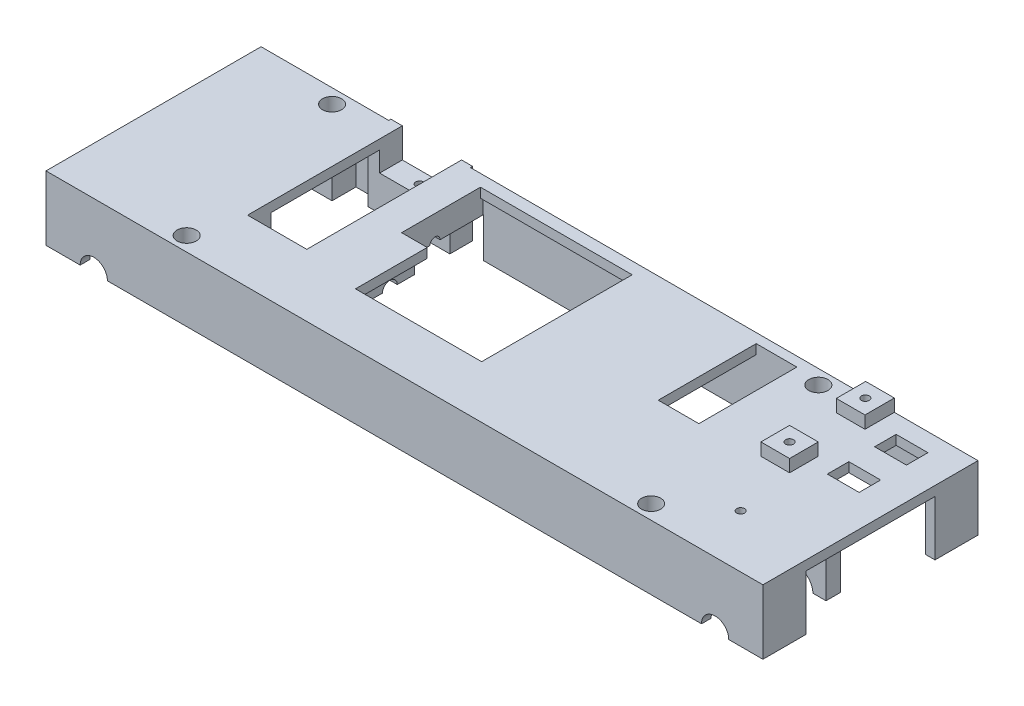
from build123d import *

# Parameters (mm, degrees)
SKETCH_1_W           = 150
SKETCH_1_H           = 45
EXTRUDE_1_DEPTH      = 2
SKETCH_3_W           = 12
SKETCH_3_H           = 3
SKETCH_3_W_2         = 3
SKETCH_3_H_2         = 10
SKETCH_3_H_3         = 10.3
SKETCH_3_W_3         = 19.4
EXTRUDE_2_DEPTH      = 11.5
CUT_EXTRUDE_1_REACH  = 90.217
SKETCH_4_R           = 2.85
CUT_EXTRUDE_2_REACH  = 129.602
SKETCH_5_R           = 1.6
EXTRUDE_START        = -13.5
SKETCH_6_W           = 18.974736579
SKETCH_6_H           = 4.7514
SKETCH_6_R           = 0.825
SKETCH_6_W_2         = 17.092
EXTRUDE_3_DEPTH      = 13.5
CUT_EXTRUDE_START    = -6.1974
SKETCH_7_W           = 12.392
SKETCH_7_H           = 32.3834
SKETCH_7_W_2         = 8.5
SKETCH_7_H_2         = 20.5
CUT_EXTRUDE_3_DEPTH  = 6.1974
SKETCH_8_W           = 2.5
SKETCH_8_H           = 9
SKETCH_8_H_2         = 8
EXTRUDE_4_DEPTH      = 20
SKETCH_9_W           = 4.5
SKETCH_9_H           = 26.7
SKETCH_9_W_2         = 6.45
EXTRUDE_5_DEPTH      = 3.3
SKETCH_10_W          = 6.45
SKETCH_10_H          = 11.7
EXTRUDE_6_DEPTH      = 4.2
CUT_EXTRUDE_START_2  = -2
SKETCH_12_R          = 1.55
SKETCH_12_R_2        = 1.05
CUT_EXTRUDE_4_DEPTH  = 37.7
SKETCH_14_W          = 6.65
SKETCH_14_H          = 8.3
SKETCH_14_W_2        = 4.7
CUT_EXTRUDE_5_DEPTH  = 2.1
CUT_EXTRUDE_6_REACH  = 82.009
SKETCH_15_R          = 0.825
CUT_EXTRUDE_7_REACH  = 82.943
SKETCH_17_W          = 6.65
SKETCH_17_H          = 4.500055298
SKETCH_18_W          = 6
SKETCH_18_H          = 6.15
SKETCH_18_H_2        = 6
EXTRUDE_7_DEPTH      = 2.6
CUT_EXTRUDE_8_REACH  = 84.201
SKETCH_19_R          = 0.825
SKETCH_21_W          = 8
SKETCH_21_H          = 5
SKETCH_21_W_2        = 7
EXTRUDE_9_DEPTH      = 13.5
SKETCH_22_R          = 2
CUT_EXTRUDE_9_DEPTH  = 11.5
CUT_EXTRUDE_10_REACH = 83.46
SKETCH_23_R          = 1
CUT_EXTRUDE_START_3  = -17.2
SKETCH_24_R          = 3.25
CUT_EXTRUDE_11_DEPTH = 15.7
CUT_EXTRUDE_12_REACH = 83.46
SKETCH_20_R          = 0.825


with BuildPart() as part:
    # 草图1 → 凸台-拉伸1 (new body)
    with BuildSketch(Plane(origin=(0, 0, 0), x_dir=(1, 0, 0), z_dir=(0, 1, 0))):
        Rectangle(SKETCH_1_W, SKETCH_1_H)
    extrude(amount=EXTRUDE_1_DEPTH)

    # 草图3 → 凸台-拉伸2 (add)
    with BuildSketch(Plane.XZ):
        Polygon((-75, 13.5), (-73, 13.5), (-73, 20.5), (73, 20.5), (73, 13.5), (75, 13.5), (75, 22.5), (-75, 22.5), align=None)
        Polygon((-75, -13.5), (-73, -13.5), (-73, -20.5), (73, -20.5), (73, -13.5), (75, -13.5), (75, -22.5), (-75, -22.5), align=None)
        with Locations((65, 3.8)):
            Rectangle(SKETCH_3_W, SKETCH_3_H)
        with Locations((-65, 3.8)):
            Rectangle(SKETCH_3_W, SKETCH_3_H)
        with Locations((-65, -8.9)):
            Rectangle(SKETCH_3_W, SKETCH_3_H)
        with Locations((-48.574736579, 11.5)):
            Rectangle(SKETCH_3_W_2, SKETCH_3_H_2)
        with Locations((-25.35, 11.35)):
            Rectangle(SKETCH_3_W_2, SKETCH_3_H_3)
        with Locations((48.614736579, 11.5)):
            Rectangle(SKETCH_3_W_2, SKETCH_3_H_2)
        with Locations((21.3, 1.5)):
            Rectangle(SKETCH_3_W_3, SKETCH_3_H)
    extrude(amount=EXTRUDE_2_DEPTH)

    # 切除-拉伸1: up to this face of the body (flat: up to its plane)
    cut_extrude_1_end = Plane(part.part.faces().sort_by_distance((0, -4.75, 22.5))[0])
    # 草图4 → 切除-拉伸1 (cut, up to the picked face)
    with BuildSketch(Plane(origin=(0, 0, -22.5), x_dir=(-1, 0, 0), z_dir=(0, 0, -1)), mode=Mode.PRIVATE) as cut_extrude_1_sk1:
        with Locations((-65, -11.5)):
            Circle(SKETCH_4_R)
    cut_extrude_1_tool1 = split(extrude(cut_extrude_1_sk1.sketch, amount=-CUT_EXTRUDE_1_REACH, mode=Mode.PRIVATE), bisect_by=cut_extrude_1_end, keep=Keep.BOTH, mode=Mode.PRIVATE)
    # 草图4 → 切除-拉伸1 (cut, up to the picked face)
    with BuildSketch(Plane(origin=(0, 0, -22.5), x_dir=(-1, 0, 0), z_dir=(0, 0, -1)), mode=Mode.PRIVATE) as cut_extrude_1_sk2:
        with Locations((65, -11.5)):
            Circle(SKETCH_4_R)
    cut_extrude_1_tool2 = split(extrude(cut_extrude_1_sk2.sketch, amount=-CUT_EXTRUDE_1_REACH, mode=Mode.PRIVATE), bisect_by=cut_extrude_1_end, keep=Keep.BOTH, mode=Mode.PRIVATE)
    add(cut_extrude_1_tool1.solids().sort_by(Axis((65, -11.5, -22.5), (0, 0, 1)))[0], mode=Mode.SUBTRACT)
    add(cut_extrude_1_tool2.solids().sort_by(Axis((-65, -11.5, -22.5), (0, 0, 1)))[0], mode=Mode.SUBTRACT)

    # 草图5 → 切除-拉伸2 (cut, up to next)
    with BuildSketch(Plane.ZY.offset(50.074736579), mode=Mode.PRIVATE) as cut_extrude_2_sk1:
        with Locations((11.5, -11.5)):
            Circle(SKETCH_5_R)
    cut_extrude_2_tool1 = extrude(cut_extrude_2_sk1.sketch, amount=-CUT_EXTRUDE_2_REACH, mode=Mode.PRIVATE) & part.part
    add(cut_extrude_2_tool1.solids().sort_by_distance((-50.074737, -11.5, 11.5))[0], mode=Mode.SUBTRACT)
    add(cut_extrude_2_tool1.solids().sort_by_distance((-50.074737, -11.5, 11.5))[1], mode=Mode.SUBTRACT)
    add(cut_extrude_2_tool1.solids().sort_by_distance((-50.074737, -11.5, 11.5))[2], mode=Mode.SUBTRACT)

    # 草图6 → 凸台-拉伸3 (add)
    # profile 1 of 2: a face of its own
    with BuildSketch(Plane(origin=(0, 2, 0), x_dir=(1, 0, 0), z_dir=(0, 1, 0)).offset(EXTRUDE_START)):
        with Locations((-40.58736829, -6.9563)):
            Rectangle(SKETCH_6_W, SKETCH_6_H)
        with Locations(Location((-39.696, -6.7666, 0), (0, 0, 270))):
            Circle(SKETCH_6_R, mode=Mode.SUBTRACT)
    # profile 2 of 2: a face of its own
    with BuildSketch(Plane(origin=(0, 2, 0), x_dir=(1, 0, 0), z_dir=(0, 1, 0)).offset(EXTRUDE_START)):
        with Locations((-39.746, 20.5757)):
            Rectangle(SKETCH_6_W_2, SKETCH_6_H)
        with Locations((-39.696, 20.386)):
            Circle(SKETCH_6_R, mode=Mode.SUBTRACT)
    extrude(amount=EXTRUDE_3_DEPTH)

    # 草图7 → 切除-拉伸3 (cut)
    with BuildSketch(Plane(origin=(0, 2, 0), x_dir=(1, 0, 0), z_dir=(0, 1, 0)).offset(CUT_EXTRUDE_START)):
        with Locations((-39.696, 6.7597)):
            Rectangle(SKETCH_7_W, SKETCH_7_H)
        Polygon((-26.6, 20), (5.15, 20), (5.15, -11.5), (-21.25, -11.5), (-21.25, -3.25), (-21.25, 3.5), (-26.6, 3.5), align=None)
        with Locations((34.85, 10.25)):
            Rectangle(SKETCH_7_W_2, SKETCH_7_H_2)
    extrude(amount=CUT_EXTRUDE_3_DEPTH, mode=Mode.SUBTRACT)

    # 草图8 → 凸台-拉伸4 (add)
    with BuildSketch(Plane.XZ):
        with Locations((40.35, -4.5)):
            Rectangle(SKETCH_8_W, SKETCH_8_H)
        with Locations((40.35, -16.5)):
            Rectangle(SKETCH_8_W, SKETCH_8_H_2)
    extrude(amount=EXTRUDE_4_DEPTH)

    # 草图9 → 凸台-拉伸5 (add)
    with BuildSketch(Plane.XZ):
        with Locations((-28.85, -7.15)):
            Rectangle(SKETCH_9_W, SKETCH_9_H)
        with Locations((8.375, -7.15)):
            Rectangle(SKETCH_9_W_2, SKETCH_9_H)
    extrude(amount=EXTRUDE_5_DEPTH)

    # 草图10 → 凸台-拉伸6 (add)
    with BuildSketch(Plane.XZ):
        with Locations((8.375, 0.35)):
            Rectangle(SKETCH_10_W, SKETCH_10_H)
        Polygon((-31.1, 6.2), (-23.85, 6.2), (-23.85, -3.5), (-26.6, -3.5), (-26.6, -6.5), (-31.1, -6.5), align=None)
    extrude(amount=EXTRUDE_6_DEPTH)

    # 草图12 → 切除-拉伸4 (cut)
    with BuildSketch(Plane.ZY.offset(31.1).offset(CUT_EXTRUDE_START_2)):
        with Locations((1.7, -4.2)):
            Circle(SKETCH_12_R)
        with Locations((-10.5, -3.3)):
            Circle(SKETCH_12_R_2)
    extrude(amount=-CUT_EXTRUDE_4_DEPTH, mode=Mode.SUBTRACT)

    # 草图14 → 切除-拉伸5 (cut)
    with BuildSketch(Plane(origin=(0, 0, -22.5), x_dir=(-1, 0, 0), z_dir=(0, 0, -1))):
        with Locations((-8.375, -7.35)):
            Rectangle(SKETCH_14_W, SKETCH_14_H)
        with Locations((28.85, -7.35)):
            Rectangle(SKETCH_14_W_2, SKETCH_14_H)
    extrude(amount=-CUT_EXTRUDE_5_DEPTH, mode=Mode.SUBTRACT)

    # 草图15 → 切除-拉伸6 (cut, up to next)
    with BuildSketch(Plane(origin=(0, -4.1974, 0), x_dir=(1, 0, 0), z_dir=(0, 1, 0)), mode=Mode.PRIVATE) as cut_extrude_6_sk1:
        with Locations(Location((-39.696, 20.386, 0), (0, 0, 90))):
            Circle(SKETCH_15_R)
    cut_extrude_6_tool1 = extrude(cut_extrude_6_sk1.sketch, amount=-CUT_EXTRUDE_6_REACH, mode=Mode.PRIVATE) & part.part
    add(cut_extrude_6_tool1.solids().sort_by_distance((-39.696, -4.1974, -20.386))[0], mode=Mode.SUBTRACT)

    # 草图17 → 切除-拉伸7 (cut, up to next)
    with BuildSketch(Plane.XZ, mode=Mode.PRIVATE) as cut_extrude_7_sk1:
        with Locations((65, -6.549972351)):
            Rectangle(SKETCH_17_W, SKETCH_17_H)
    cut_extrude_7_tool1 = extrude(cut_extrude_7_sk1.sketch, amount=-CUT_EXTRUDE_7_REACH, mode=Mode.PRIVATE) & part.part
    # 草图17 → 切除-拉伸7 (cut, up to next)
    with BuildSketch(Plane.XZ, mode=Mode.PRIVATE) as cut_extrude_7_sk2:
        with Locations((65, -16.450027649)):
            Rectangle(SKETCH_17_W, SKETCH_17_H)
    cut_extrude_7_tool2 = extrude(cut_extrude_7_sk2.sketch, amount=-CUT_EXTRUDE_7_REACH, mode=Mode.PRIVATE) & part.part
    add(cut_extrude_7_tool1.solids().sort_by_distance((65, 0, -6.549972))[0], mode=Mode.SUBTRACT)
    add(cut_extrude_7_tool2.solids().sort_by_distance((65, 0, -16.450028))[0], mode=Mode.SUBTRACT)

    # 草图18 → 凸台-拉伸7 (add)
    with BuildSketch(Plane(origin=(0, 2, 0), x_dir=(1, 0, 0), z_dir=(0, 1, 0))):
        with Locations((54.5, 19.425)):
            Rectangle(SKETCH_18_W, SKETCH_18_H)
        with Locations((54.5, 3.575)):
            Rectangle(SKETCH_18_W, SKETCH_18_H_2)
    extrude(amount=EXTRUDE_7_DEPTH)

    # 草图19 → 切除-拉伸8 (cut, up to next)
    with BuildSketch(Plane(origin=(0, 4.6, 0), x_dir=(1, 0, 0), z_dir=(0, 1, 0)), mode=Mode.PRIVATE) as cut_extrude_8_sk1:
        with Locations(Location((54.5, 3.575, 0), (0, 0, 270))):
            Circle(SKETCH_19_R)
    cut_extrude_8_tool1 = extrude(cut_extrude_8_sk1.sketch, amount=-CUT_EXTRUDE_8_REACH, mode=Mode.PRIVATE) & part.part
    # 草图19 → 切除-拉伸8 (cut, up to next)
    with BuildSketch(Plane(origin=(0, 4.6, 0), x_dir=(1, 0, 0), z_dir=(0, 1, 0)), mode=Mode.PRIVATE) as cut_extrude_8_sk2:
        with Locations(Location((54.5, 19.425, 0), (0, 0, 270))):
            Circle(SKETCH_19_R)
    cut_extrude_8_tool2 = extrude(cut_extrude_8_sk2.sketch, amount=-CUT_EXTRUDE_8_REACH, mode=Mode.PRIVATE) & part.part
    add(cut_extrude_8_tool1.solids().sort_by_distance((54.5, 4.6, -3.575))[0], mode=Mode.SUBTRACT)
    add(cut_extrude_8_tool2.solids().sort_by_distance((54.5, 4.6, -19.425))[0], mode=Mode.SUBTRACT)

    # 草图21 → 凸台-拉伸9 (add)
    with BuildSketch(Plane(origin=(0, 2, 0), x_dir=(1, 0, 0), z_dir=(0, 1, 0))):
        with Locations((-48.574736579, -18)):
            Rectangle(SKETCH_21_W, SKETCH_21_H)
        with Locations((-57.15, 18)):
            Rectangle(SKETCH_21_W, SKETCH_21_H)
        with Locations((45.1, 18)):
            Rectangle(SKETCH_21_W_2, SKETCH_21_H)
        with Locations((48.614736579, -18)):
            Rectangle(SKETCH_21_W, SKETCH_21_H)
    extrude(amount=-EXTRUDE_9_DEPTH)

    # 草图22 → 上下盖螺孔切除-拉伸9 (cut)
    with BuildSketch(Plane(origin=(0, 2, 0), x_dir=(1, 0, 0), z_dir=(0, 1, 0))):
        with Locations(Location((-48.574736579, -19.5, 0), (0, 0, 270))):
            Circle(SKETCH_22_R)
        with Locations(Location((48.614736579, -19.5, 0), (0, 0, 270))):
            Circle(SKETCH_22_R)
        with Locations(Location((44.6, 19.5, 0), (0, 0, 270))):
            Circle(SKETCH_22_R)
        with Locations(Location((-57.15, 19.5, 0), (0, 0, 270))):
            Circle(SKETCH_22_R)
    extrude(amount=-CUT_EXTRUDE_9_DEPTH, mode=Mode.SUBTRACT)

    # 草图23 → 切除-拉伸10 (cut, up to next)
    with BuildSketch(Plane(origin=(0, 2, 0), x_dir=(1, 0, 0), z_dir=(0, 1, 0)), mode=Mode.PRIVATE) as cut_extrude_10_sk1:
        with Locations(Location((-57.15, 19.5, 0), (0, 0, 270))):
            Circle(SKETCH_23_R)
    cut_extrude_10_tool1 = extrude(cut_extrude_10_sk1.sketch, amount=-CUT_EXTRUDE_10_REACH, mode=Mode.PRIVATE) & part.part
    # 草图23 → 切除-拉伸10 (cut, up to next)
    with BuildSketch(Plane(origin=(0, 2, 0), x_dir=(1, 0, 0), z_dir=(0, 1, 0)), mode=Mode.PRIVATE) as cut_extrude_10_sk2:
        with Locations(Location((-48.574736579, -19.5, 0), (0, 0, 270))):
            Circle(SKETCH_23_R)
    cut_extrude_10_tool2 = extrude(cut_extrude_10_sk2.sketch, amount=-CUT_EXTRUDE_10_REACH, mode=Mode.PRIVATE) & part.part
    # 草图23 → 切除-拉伸10 (cut, up to next)
    with BuildSketch(Plane(origin=(0, 2, 0), x_dir=(1, 0, 0), z_dir=(0, 1, 0)), mode=Mode.PRIVATE) as cut_extrude_10_sk3:
        with Locations(Location((48.614736579, -19.5, 0), (0, 0, 270))):
            Circle(SKETCH_23_R)
    cut_extrude_10_tool3 = extrude(cut_extrude_10_sk3.sketch, amount=-CUT_EXTRUDE_10_REACH, mode=Mode.PRIVATE) & part.part
    # 草图23 → 切除-拉伸10 (cut, up to next)
    with BuildSketch(Plane(origin=(0, 2, 0), x_dir=(1, 0, 0), z_dir=(0, 1, 0)), mode=Mode.PRIVATE) as cut_extrude_10_sk4:
        with Locations(Location((44.6, 19.5, 0), (0, 0, 270))):
            Circle(SKETCH_23_R)
    cut_extrude_10_tool4 = extrude(cut_extrude_10_sk4.sketch, amount=-CUT_EXTRUDE_10_REACH, mode=Mode.PRIVATE) & part.part
    add(cut_extrude_10_tool1.solids().sort_by_distance((-57.15, 2, -19.5))[0], mode=Mode.SUBTRACT)
    add(cut_extrude_10_tool2.solids().sort_by_distance((-48.574737, 2, 19.5))[0], mode=Mode.SUBTRACT)
    add(cut_extrude_10_tool3.solids().sort_by_distance((48.614737, 2, 19.5))[0], mode=Mode.SUBTRACT)
    add(cut_extrude_10_tool4.solids().sort_by_distance((44.6, 2, -19.5))[0], mode=Mode.SUBTRACT)

    # 草图24 → 切除-拉伸11 (cut)
    with BuildSketch(Plane.XY.offset(22.5).offset(CUT_EXTRUDE_START_3)):
        with Locations((65, -11.5)):
            Circle(SKETCH_24_R)
        with Locations((-65, -11.5)):
            Circle(SKETCH_24_R)
    extrude(amount=-CUT_EXTRUDE_11_DEPTH, mode=Mode.SUBTRACT)

    # 草图20 → 主板固定切除-拉伸12 (cut, up to next)
    with BuildSketch(Plane(origin=(0, 2, 0), x_dir=(1, 0, 0), z_dir=(0, 1, 0)), mode=Mode.PRIVATE) as cut_extrude_12_sk1:
        with Locations(Location((59.263652527, -11.432689865, 0), (0, 0, 270))):
            Circle(SKETCH_20_R)
    cut_extrude_12_tool1 = extrude(cut_extrude_12_sk1.sketch, amount=-CUT_EXTRUDE_12_REACH, mode=Mode.PRIVATE) & part.part
    add(cut_extrude_12_tool1.solids().sort_by_distance((59.263653, 2, 11.43269))[0], mode=Mode.SUBTRACT)


solid = part.part
